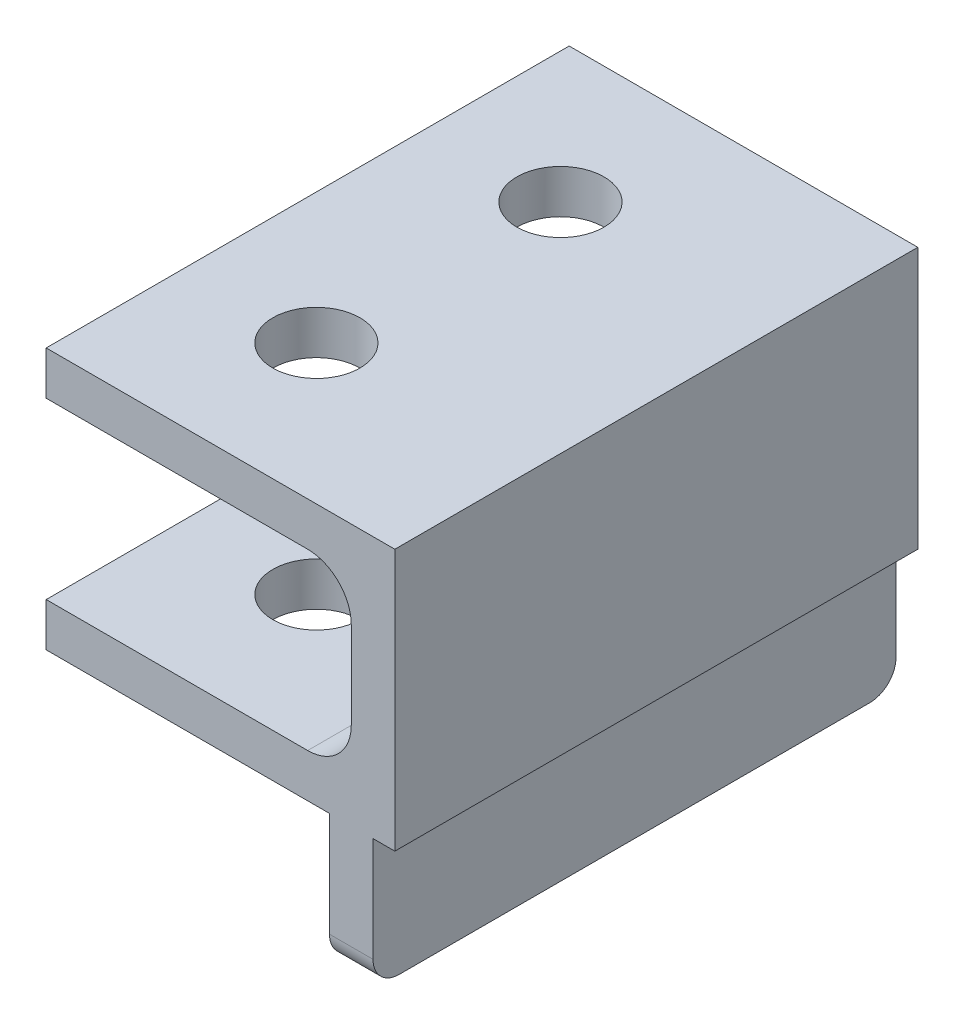
from build123d import *

# Parameters (mm, degrees)
BOSS_EXTRUDE1_DEPTH = 60
FILLET1_R           = 5
SKETCH2_R           = 5
CUT_EXTRUDE1_DEPTH  = 75
SKETCH3_W           = 5
SKETCH3_H           = 60
BOSS_EXTRUDE2_DEPTH = 15
FILLET3_R           = 3


with BuildPart() as part:
    # Sketch1 → Boss-Extrude1 (new body)
    with BuildSketch(Plane.XY):
        Polygon((0, 0), (35, 0), (35, -20), (0, -20), (0, -25), (40, -25), (40, 5), (0, 5), align=None)
    extrude(amount=BOSS_EXTRUDE1_DEPTH)

    # Fillet1
    fillet1_edges = [part.edges().sort_by_distance(p)[0] for p in [
        (35, -20, 30),
        (35, 0, 30),
    ]]
    fillet(fillet1_edges, radius=FILLET1_R)

    # Sketch2 → Cut-Extrude1 (cut)
    with BuildSketch(Plane(origin=(0, 5, 0), x_dir=(1, 0, 0), z_dir=(0, 1, 0))):
        with Locations(Location((15, -44, 0), (0, 0, 180))):
            Circle(SKETCH2_R)
        with Locations(Location((15, -16, 0), (0, 0, 270))):
            Circle(SKETCH2_R)
    extrude(amount=-CUT_EXTRUDE1_DEPTH, mode=Mode.SUBTRACT)

    # Sketch3 → Boss-Extrude2 (add)
    with BuildSketch(Plane.XZ.offset(25)):
        with Locations((35, 30)):
            Rectangle(SKETCH3_W, SKETCH3_H)
    extrude(amount=BOSS_EXTRUDE2_DEPTH)

    # Fillet3
    fillet3_edges = [part.edges().sort_by_distance(p)[0] for p in [
        (35, -40, 0),
        (35, -40, 60),
    ]]
    fillet(fillet3_edges, radius=FILLET3_R)


solid = part.part
